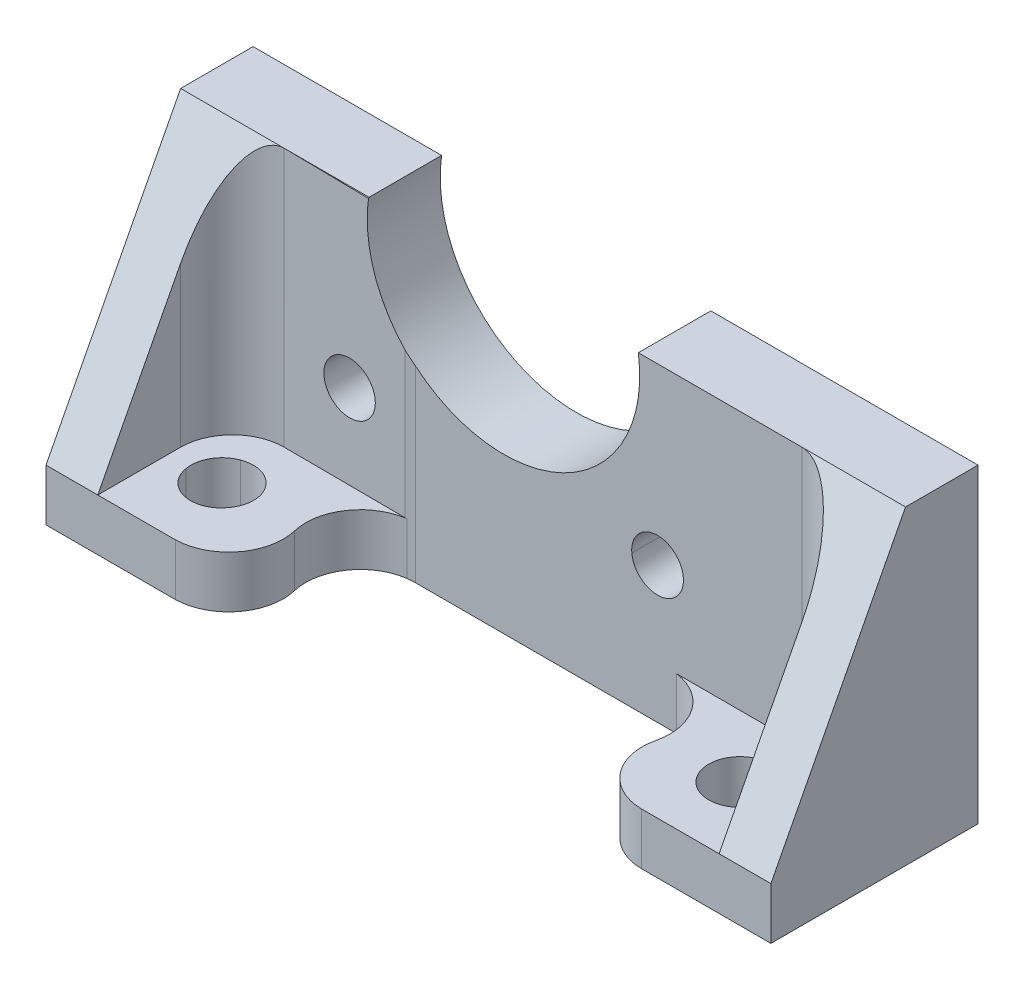
from build123d import *

# Parameters (mm, degrees)
SKETCH1_W           = 70
SKETCH1_H           = 30
BOSS_EXTRUDE1_DEPTH = 20
SKETCH1_3_R         = 2.497207735
CUT_EXTRUDE2_DEPTH  = 79.74007874
CUT_EXTRUDE3_DEPTH  = 79.74007874
CUT_EXTRUDE7_DEPTH  = 79.74007874
BOSS_EXTRUDE3_DEPTH = 5
CUT_EXTRUDE8_DEPTH  = 79.74007874


with BuildPart() as part:
    # Sketch1 → Boss-Extrude1 (new body)
    with BuildSketch(Plane.XY):
        with Locations((-35, 15)):
            Rectangle(SKETCH1_W, SKETCH1_H)
    boss_extrude1 = extrude(amount=BOSS_EXTRUDE1_DEPTH)

    # Sketch1<3> → Cut-Extrude2 (cut, through all)
    with BuildSketch(Plane.XY):
        with BuildLine():
            Line((-18.200000763, 30), (-44.200000763, 30))
            ThreePointArc((-44.200000763, 30), (-31.200000763, 15), (-18.200000763, 30))
        make_face()
        with BuildLine():
            ThreePointArc((-43.56823349, 12.933696747), (-44.064114621, 14.676308172), (-45.615119934, 15.61277771))
            ThreePointArc((-45.615119934, 15.61277771), (-48.042503261, 11.636717399), (-43.56823349, 12.933696747))
        make_face()
        with Locations((-16.347953451, 13.143053079)):
            Circle(SKETCH1_3_R)
    cut_extrude2 = extrude(amount=CUT_EXTRUDE2_DEPTH, mode=Mode.SUBTRACT)

    # Sketch2 → Cut-Extrude3 (cut, through all)
    with BuildSketch(Plane.ZY.offset(70)):
        Polygon((20, 30), (7, 30), (20, 5), align=None)
    cut_extrude3 = extrude(amount=-CUT_EXTRUDE3_DEPTH, mode=Mode.SUBTRACT)

    # Mirror1: Boss-Extrude1, Cut-Extrude2, Cut-Extrude3 across plane
    add(boss_extrude1.mirror(Plane(origin=(0, 30, 20), x_dir=(0, 0, 1), z_dir=(1, 0, 0))))
    add(cut_extrude2.mirror(Plane(origin=(0, 30, 20), x_dir=(0, 0, 1), z_dir=(1, 0, 0))), mode=Mode.SUBTRACT)
    add(cut_extrude3.mirror(Plane(origin=(0, 30, 20), x_dir=(0, 0, 1), z_dir=(1, 0, 0))), mode=Mode.SUBTRACT)

    # Sketch4 → Cut-Extrude7 (cut, through all)
    with BuildSketch(Plane(origin=(0, 0, 0), x_dir=(1, 0, 0), z_dir=(0, 1, 0))):
        with BuildLine():
            Line((5, -11.999999865), (5, -20))
            Line((5, -20), (65, -20))
            Line((65, -20), (65, -12))
            ThreePointArc((65, -12), (63.535533906, -8.464466094), (60, -7))
            Line((60, -7), (22.686811447, -7))
            Line((22.686811447, -7), (21.717826843, -7.061558247))
            Line((21.717826843, -7.061558247), (10, -7))
            ThreePointArc((10, -7), (6.464466102, -8.464466007), (5, -11.999999865))
        make_face()
    extrude(amount=CUT_EXTRUDE7_DEPTH, mode=Mode.SUBTRACT)

    # Sketch4<6> → Boss-Extrude3 (add)
    # profile 1 of 2: a face of its own
    with BuildSketch(Plane(origin=(0, 0, 0), x_dir=(1, 0, 0), z_dir=(0, 1, 0))):
        with BuildLine():
            Line((5, -11.999999865), (5, -20))
            Line((5, -20), (12.5, -20))
            ThreePointArc((12.5, -20), (16.552378538, -17.944137337), (17.5, -13.5))
            ThreePointArc((17.5, -13.5), (18.286173232, -9.293081984), (21.929830501, -7.048089949))
            Line((21.929830501, -7.048089949), (21.717826843, -7.061558247))
            Line((21.717826843, -7.061558247), (10, -7))
            ThreePointArc((10, -7), (6.464466102, -8.464466007), (5, -11.999999865))
        make_face()
        with BuildLine():
            ThreePointArc((7.045577049, -13.520944595), (7.401923496, -11.500000278), (8.973938942, -10.180922508))
            ThreePointArc((8.973938942, -10.180922508), (12.387007699, -11.175196953), (12.37415177, -14.730116746))
            ThreePointArc((12.37415177, -14.730116746), (9.302656578, -15.920012423), (7.045577049, -13.520944595))
        make_face(mode=Mode.SUBTRACT)
    # profile 2 of 2: a face of its own
    with BuildSketch(Plane(origin=(0, 0, 0), x_dir=(1, 0, 0), z_dir=(0, 1, 0))):
        with BuildLine():
            Line((57.5, -20), (65, -20))
            Line((65, -20), (65, -12))
            ThreePointArc((65, -12), (63.535533906, -8.464466094), (60, -7))
            Line((60, -7), (47.881000272, -7))
            ThreePointArc((47.881000272, -7), (51.610779808, -9.240727474), (52.5, -13.5))
            ThreePointArc((52.5, -13.5), (53.428531793, -17.958821698), (57.5, -20))
        make_face()
        with BuildLine():
            ThreePointArc((58.071636237, -15.298134071), (57.54254335, -11.279271131), (61.499999792, -10.401924497))
            ThreePointArc((61.499999792, -10.401924497), (62.999999734, -13.000000826), (61.499999759, -15.598077136))
            ThreePointArc((61.499999759, -15.598077136), (59.738532149, -15.988585106), (58.071636237, -15.298134071))
        make_face(mode=Mode.SUBTRACT)
    extrude(amount=BOSS_EXTRUDE3_DEPTH)

    # Sketch11 → Cut-Extrude8 (cut, through all)
    with BuildSketch(Plane(origin=(0, 0, 0), x_dir=(0, 0, -1), z_dir=(1, 0, 0))):
        Polygon((0, 0), (0, 30), (-7, 30), (-20, 5), (-20, 0), align=None)
    extrude(amount=-CUT_EXTRUDE8_DEPTH, mode=Mode.SUBTRACT)


solid = part.part
